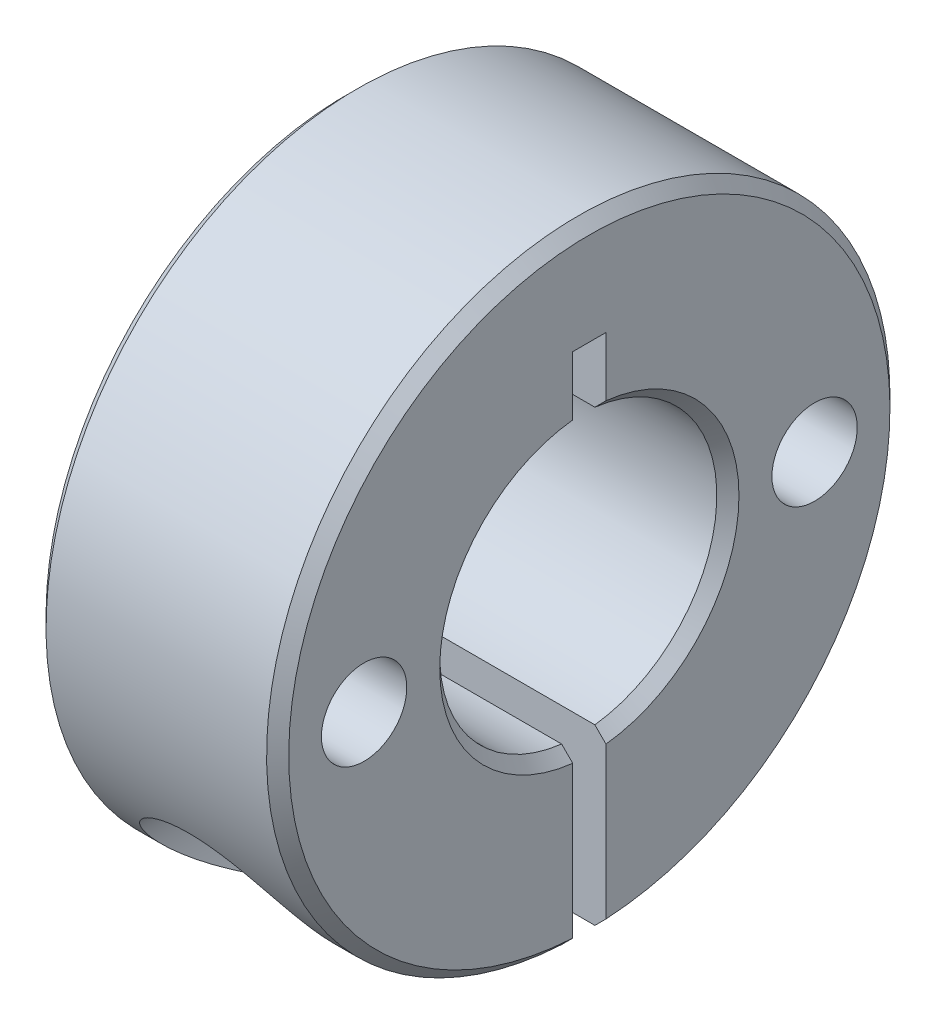
from build123d import *

# Parameters (mm, degrees)
CUT_EXTRUDE1_DEPTH      = 5.5626
CUT_EXTRUDE1_DEPTH_BACK = 5.5626
SKETCH2_W               = 1.524
SKETCH2_H               = 23.8125
SKETCH5_W               = 11.1252
SKETCH5_H               = 1.9558
SKETCH6_W               = 11.1252
SKETCH6_H               = 1.9558


with BuildPart() as part:
    # Sketch1 → Revolve1 (revolve)
    with BuildSketch(Plane.XY):
        Polygon((-5.5626, 6.858), (-5.0546, 6.35), (5.0546, 6.35), (5.5626, 6.858), (5.5626, 13.7795), (5.0546, 14.2875), (-5.0546, 14.2875), (-5.5626, 13.7795), align=None)
    revolve(axis=Axis((5.5626, 0, 0), (-1, 0, 0)))

    # Sketch2 → Cut-Extrude1 (cut, two sides: drawn at the far end of the back side and taken through both)
    with BuildSketch(Plane(origin=(0, 0, 0), x_dir=(0, 0, -1), z_dir=(1, 0, 0)).offset(-CUT_EXTRUDE1_DEPTH_BACK)):
        with Locations((0, -2.38125)):
            Rectangle(SKETCH2_W, SKETCH2_H)
    extrude(amount=CUT_EXTRUDE1_DEPTH + CUT_EXTRUDE1_DEPTH_BACK, mode=Mode.SUBTRACT)

    # Sketch3 → Cut-Revolve1 (revolve, cut)
    with BuildSketch(Plane(origin=(0, 0, 0), x_dir=(0, 0, -1), z_dir=(1, 0, 0))):
        Polygon((-14.2875, -10.3124), (-14.2875, -6.35), (-3.5814, -6.35), (-3.5814, -8.0264), (0, -8.0264), (0, -10.3124), align=None)
    revolve(axis=Axis((0, -10.3124, 0), (0, 0, 1)), mode=Mode.SUBTRACT)

    # Sketch4 → Cut-Revolve2 (revolve, cut)
    with BuildSketch(Plane(origin=(0, 0, 0), x_dir=(0, 0, -1), z_dir=(1, 0, 0))):
        Polygon((0.762, -10.3124), (0.762, -8.2296), (1.1938, -8.6614), (16.2306, -8.6614), (16.2306, -10.3124), align=None)
    revolve(axis=Axis((0, -10.3124, -16.2306), (0, 0, 1)), mode=Mode.SUBTRACT)

    # Sketch5 → Cut-Revolve3 (revolve, cut)
    with BuildSketch(Plane(origin=(0, 0, 0), x_dir=(1, 0, 0), z_dir=(0, 1, 0))):
        with Locations((0, 11.303)):
            Rectangle(SKETCH5_W, SKETCH5_H)
    revolve(axis=Axis((5.5626, 0, -10.3251), (-1, 0, 0)), mode=Mode.SUBTRACT)

    # Sketch6 → Cut-Revolve4 (revolve, cut)
    with BuildSketch(Plane(origin=(0, 0, 0), x_dir=(1, 0, 0), z_dir=(0, 1, 0))):
        with Locations((0, -9.3472)):
            Rectangle(SKETCH6_W, SKETCH6_H)
    revolve(axis=Axis((5.5626, 0, 10.3251), (-1, 0, 0)), mode=Mode.SUBTRACT)


solid = part.part
